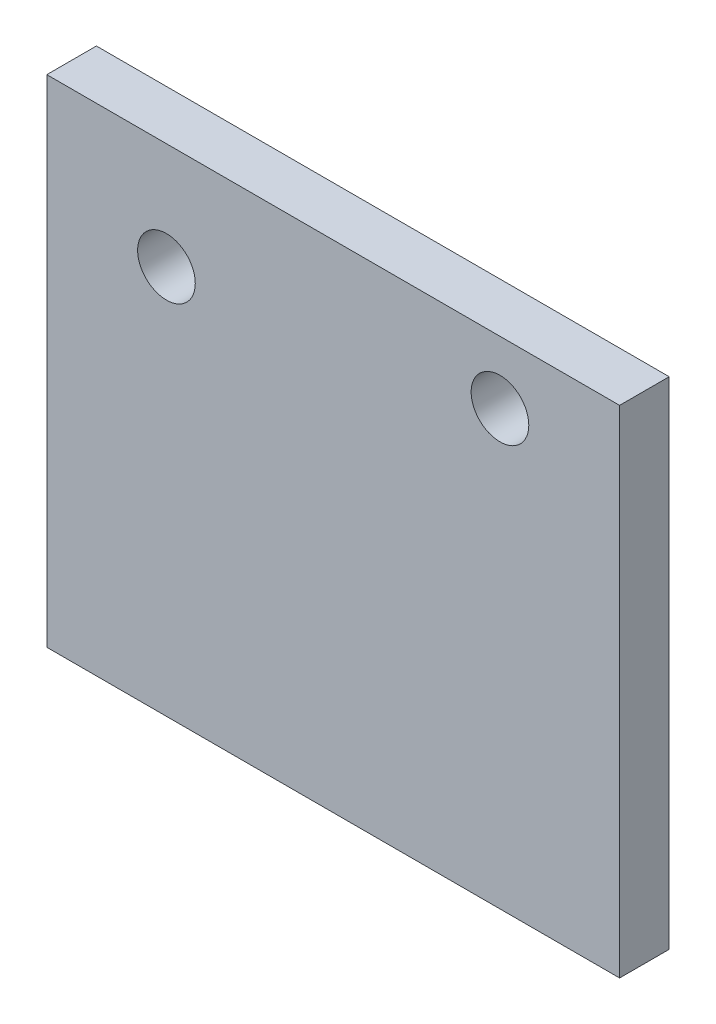
from build123d import *

# Parameters (mm, degrees)
SZKIC2_W                    = 462
SZKIC2_H                    = 400
SZKIC2_R                    = 23.25
DODANIE_WYCI_GNI_CIE1_DEPTH = 40


with BuildPart() as part:
    # Szkic2 → Dodanie-wyciągnięcie1 (new body)
    with BuildSketch(Plane.XY):
        with Locations((231, -200)):
            Rectangle(SZKIC2_W, SZKIC2_H)
        with Locations((96.5, -86)):
            Circle(SZKIC2_R, mode=Mode.SUBTRACT)
        with Locations((365.5, -50.5)):
            Circle(SZKIC2_R, mode=Mode.SUBTRACT)
    extrude(amount=DODANIE_WYCI_GNI_CIE1_DEPTH)


solid = part.part
